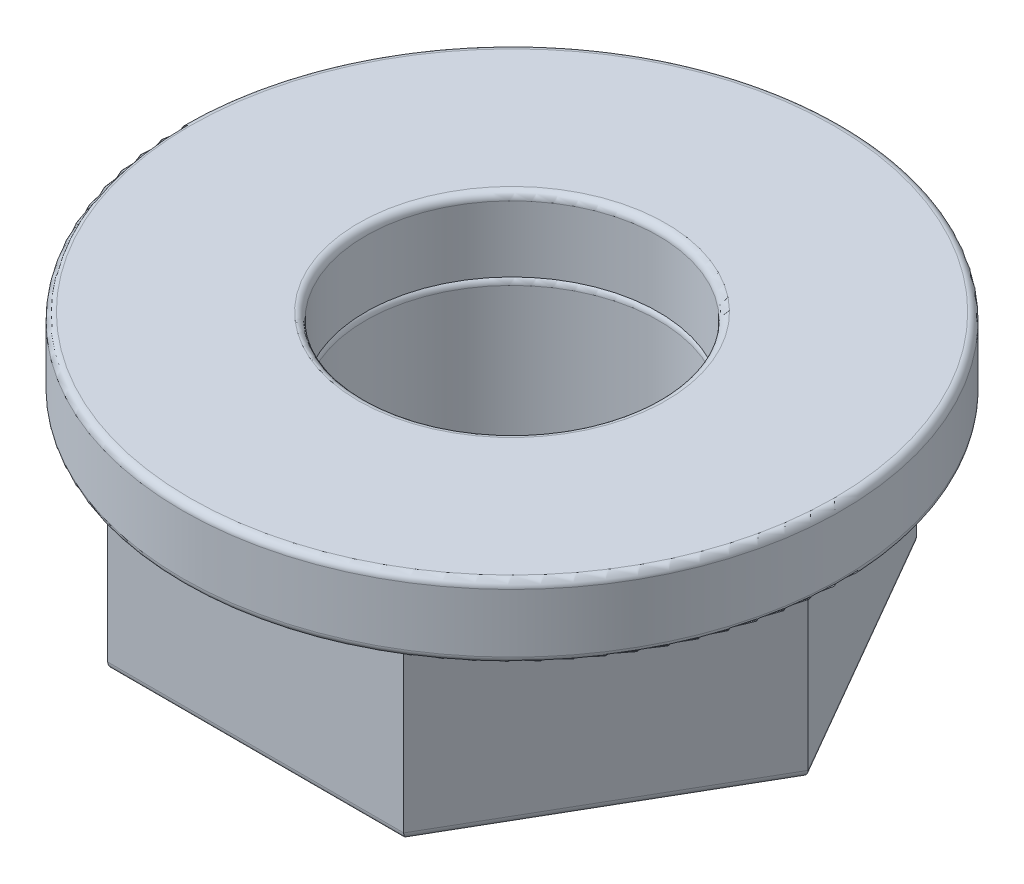
from build123d import *

# Parameters (mm, degrees)
SKETCH1_R           = 2
BOSS_EXTRUDE1_DEPTH = 2.5
FILLET1_R           = 0.1
SKETCH2_R           = 4.5
SKETCH2_R_2         = 2
BOSS_EXTRUDE2_DEPTH = 1
FILLET2_R           = 0.1


with BuildPart() as part:
    # Sketch1 → Boss-Extrude1 (new body)
    with BuildSketch(Plane(origin=(0, 0, 0), x_dir=(1, 0, 0), z_dir=(0, 1, 0))):
        Polygon((2.020725942, -3.5), (4.041451884, 0), (2.020725942, 3.5), (-2.020725942, 3.5), (-4.041451884, 0), (-2.020725942, -3.5), align=None)
        with Locations(Location((0, 0, 0), (0, 0, 270))):
            Circle(SKETCH1_R, mode=Mode.SUBTRACT)
    extrude(amount=BOSS_EXTRUDE1_DEPTH)

    # Fillet1
    fillet1_edges = [part.edges().sort_by_distance(p)[0] for p in [
        (3.031088913, 2.5, -1.75),
        (0, 2.5, -3.5),
        (-3.031088913, 2.5, -1.75),
        (0, 0, -2),
        (0, 2.5, -2),
        (-3.031088913, 2.5, 1.75),
        (0, 2.5, 3.5),
        (-3.031088913, 0, 1.75),
        (-3.031088913, 0, -1.75),
        (0, 0, -3.5),
        (3.031088913, 2.5, 1.75),
        (3.031088913, 0, -1.75),
        (3.031088913, 0, 1.75),
        (0, 0, 3.5),
    ]]
    fillet(fillet1_edges, radius=FILLET1_R)

    # Sketch2 → Boss-Extrude2 (add)
    with BuildSketch(Plane(origin=(0, 2.5, 0), x_dir=(1, 0, 0), z_dir=(0, 1, 0))):
        with Locations(Location((0, 0, 0), (0, 0, 270))):
            Circle(SKETCH2_R)
        with Locations(Location((0, 0, 0), (0, 0, 270))):
            Circle(SKETCH2_R_2, mode=Mode.SUBTRACT)
    extrude(amount=BOSS_EXTRUDE2_DEPTH)

    # Fillet2
    fillet2_edges = [part.edges().sort_by_distance(p)[0] for p in [
        (0, 3.5, -4.5),
        (0, 2.5, -4.5),
        (0, 3.5, -2),
    ]]
    fillet(fillet2_edges, radius=FILLET2_R)


solid = part.part
